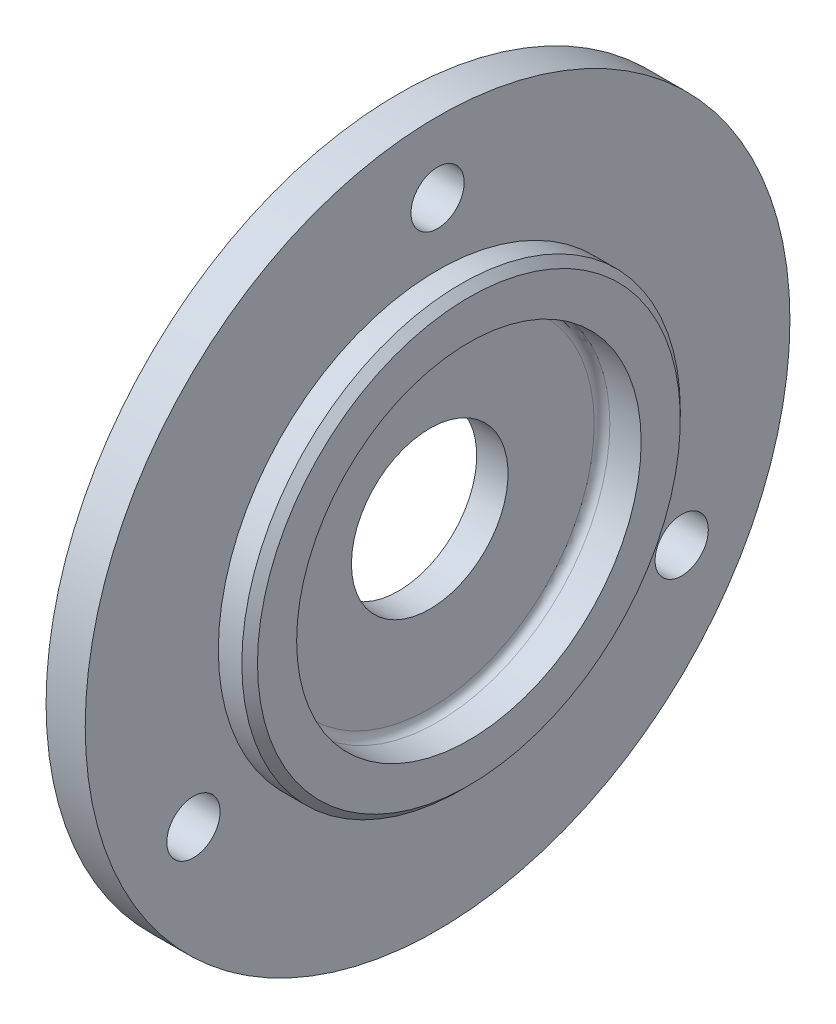
from build123d import *

# Parameters (mm, degrees)
ESQUISSE2_R             = 1.7
ENL_V_MAT_EXTRU_1_DEPTH = 10


with BuildPart() as part:
    # Esquisse1 → Révolution1 (revolve)
    with BuildSketch(Plane.XY, mode=Mode.PRIVATE) as r_volution1_sk:
        with BuildLine():
            Line((-0.5, 5), (-0.5, 10.5))
            ThreePointArc((-0.5, 10.5), (-0.353553391, 10.853553391), (0, 11))
            Line((0, 11), (2, 11))
            Line((2, 11), (2, 13.5))
            Line((2, 13.5), (1.5, 14))
            Line((1.5, 14), (0, 14))
            Line((0, 14), (0, 22.5))
            Line((0, 22.5), (-2.5, 22.5))
            Line((-2.5, 22.5), (-2.5, 5))
            Line((-2.5, 5), (-0.5, 5))
        make_face()
    revolve(r_volution1_sk.sketch.rotate(Axis((-14.777796327, 0, 0), (1, 0, 0)), 90), axis=Axis((-14.777796327, 0, 0), (1, 0, 0)))

    # Esquisse2 → Enlèv. mat.-Extru.1 (cut)
    with BuildSketch(Plane(origin=(0, 0, 0), x_dir=(0, 0, -1), z_dir=(1, 0, 0))):
        with Locations((0, 18)):
            Circle(ESQUISSE2_R)
        with Locations((15.588457268, -9)):
            Circle(ESQUISSE2_R)
        with Locations((-15.588457268, -9)):
            Circle(ESQUISSE2_R)
    extrude(amount=-ENL_V_MAT_EXTRU_1_DEPTH, mode=Mode.SUBTRACT)


solid = part.part
